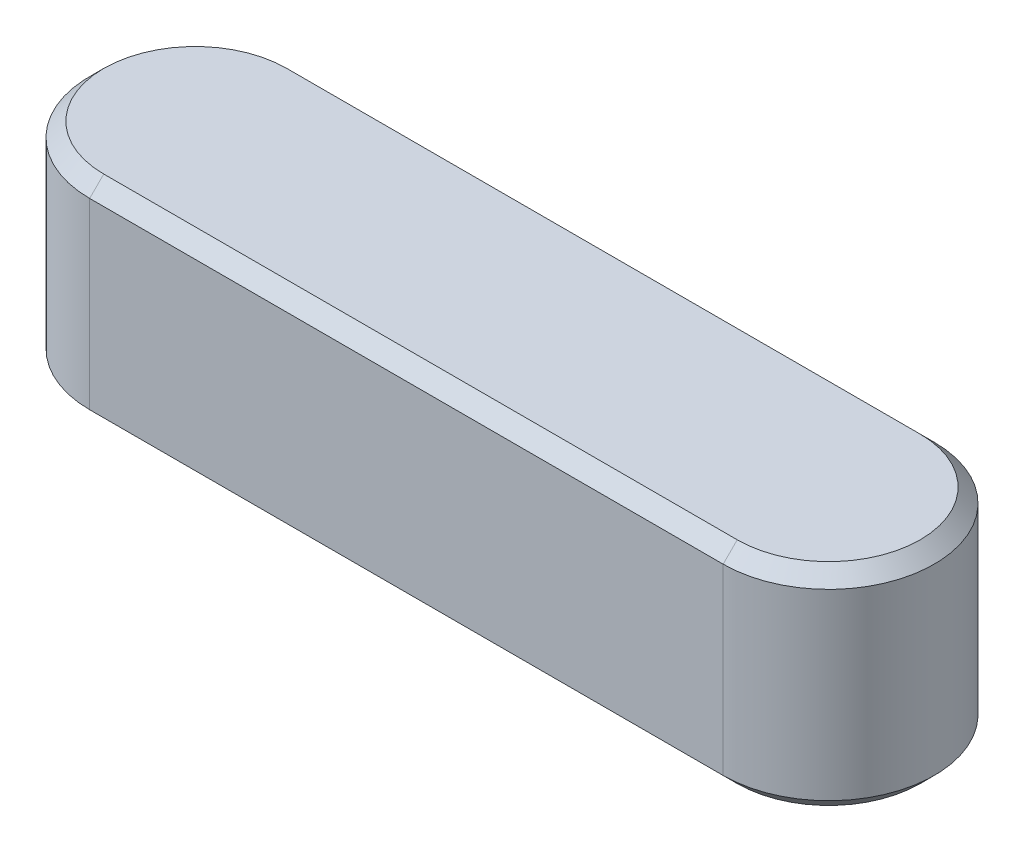
from build123d import *

# Parameters (mm, degrees)
SKETCH1_W           = 12
SKETCH1_H           = 3
BOSS_EXTRUDE1_DEPTH = 3
FILLET1_RADIUS      = 1.5
FILLET1_LENGTH      = 3
FILLET2_RADIUS      = 1.5
FILLET2_LENGTH      = 3
CHAMFER2_SIZE       = 0.2


with BuildPart() as part:
    # Sketch1 → Boss-Extrude1 (new body)
    with BuildSketch(Plane(origin=(0, 0, 0), x_dir=(1, 0, 0), z_dir=(0, 1, 0))):
        Rectangle(SKETCH1_W, SKETCH1_H)
    extrude(amount=BOSS_EXTRUDE1_DEPTH)

    # Fillet1: full round fillet: the end face becomes a half cylinder, R = half its width
    fillet1_face = Plane((-6, 1.5, 0), x_dir=(0, -1, 0), z_dir=(-1, 0, 0))  # on the end face: x along it, z out of the body
    fillet1_slab = fillet1_face.offset(-FILLET1_RADIUS / 2) * Box(FILLET1_LENGTH, 2 * FILLET1_RADIUS, FILLET1_RADIUS, mode=Mode.PRIVATE)  # the body's end, R deep
    fillet1_round = Plane((-4.5, 1.5, 0), x_dir=(-1, 0, 0), z_dir=(0, -1, 0)) * Cylinder(FILLET1_RADIUS, FILLET1_LENGTH, mode=Mode.PRIVATE)  # its axis R under the face
    add(fillet1_slab - fillet1_round, mode=Mode.SUBTRACT)

    # Fillet2: full round fillet: the end face becomes a half cylinder, R = half its width
    fillet2_face = Plane((6, 1.5, 0), x_dir=(0, 1, 0), z_dir=(1, 0, 0))  # on the end face: x along it, z out of the body
    fillet2_slab = fillet2_face.offset(-FILLET2_RADIUS / 2) * Box(FILLET2_LENGTH, 2 * FILLET2_RADIUS, FILLET2_RADIUS, mode=Mode.PRIVATE)  # the body's end, R deep
    fillet2_round = Plane((4.5, 1.5, 0), x_dir=(1, 0, 0), z_dir=(0, 1, 0)) * Cylinder(FILLET2_RADIUS, FILLET2_LENGTH, mode=Mode.PRIVATE)  # its axis R under the face
    add(fillet2_slab - fillet2_round, mode=Mode.SUBTRACT)

    # Chamfer2
    chamfer2_edges = [part.edges().sort_by_distance(p)[0] for p in [
        (0, 0, 1.5),
        (0, 3, 1.5),
        (-6, 3, 0),
        (-6, 0, 0),
        (0, 0, -1.5),
        (0, 3, -1.5),
        (6, 0, 0),
        (6, 3, 0),
    ]]
    chamfer(chamfer2_edges, length=CHAMFER2_SIZE)


solid = part.part
